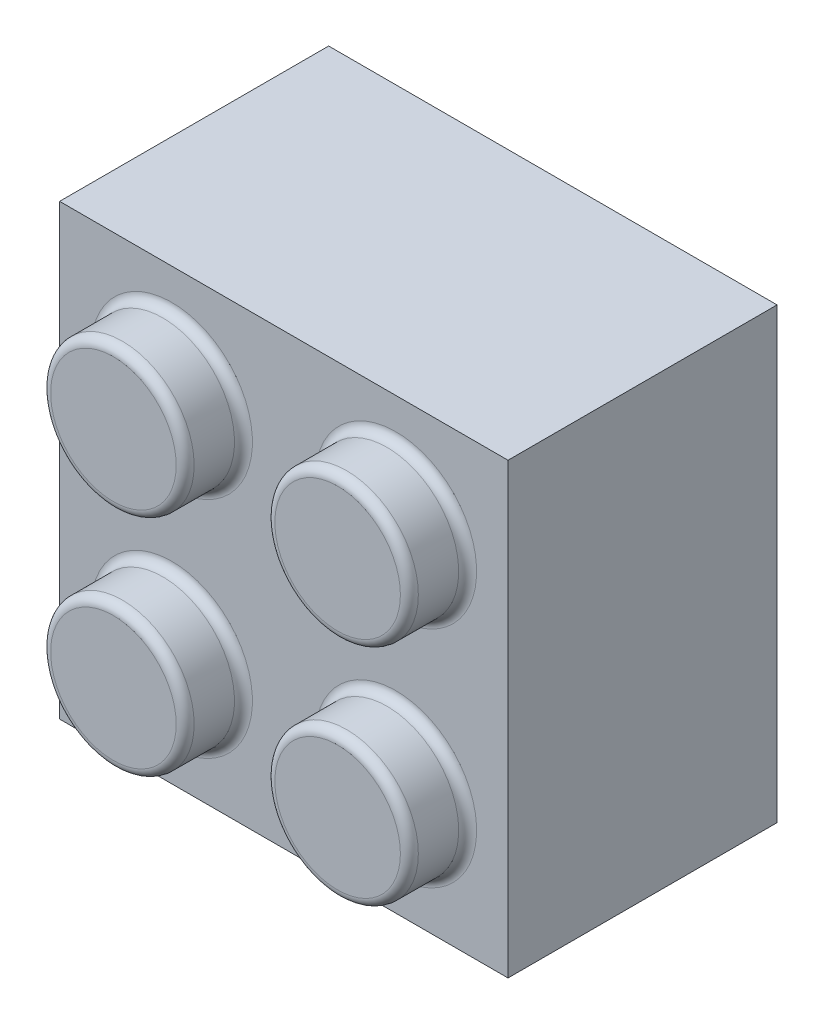
from build123d import *

# Parameters (mm, degrees)
ESQUISSE1_W             = 100
ESQUISSE1_H             = 100
BOSS_EXTRU_2_DEPTH      = 60
ESQUISSE2_R             = 16
BOSS_EXTRU_3_DEPTH      = 13
ESQUISSE3_W             = 84
ESQUISSE3_H             = 84
ESQUISSE3_R             = 18.5
ESQUISSE3_R_2           = 12
ENL_V_MAT_EXTRU_1_DEPTH = 50
CONG_1_R                = 2
CONG_2_R                = 2


with BuildPart() as part:
    # Esquisse1 → Boss.-Extru.2 (new body)
    with BuildSketch(Plane.XY):
        Rectangle(ESQUISSE1_W, ESQUISSE1_H)
    extrude(amount=BOSS_EXTRU_2_DEPTH)

    # Esquisse2 → Boss.-Extru.3 (add)
    with BuildSketch(Plane.XY.offset(60)):
        with Locations(Location((25, 25, 0), (0, 0, 180))):
            Circle(ESQUISSE2_R)
        with Locations(Location((-25, -25, 0), (0, 0, 180))):
            Circle(ESQUISSE2_R)
        with Locations(Location((25, -25, 0), (0, 0, 180))):
            Circle(ESQUISSE2_R)
        with Locations(Location((-25, 25, 0), (0, 0, 180))):
            Circle(ESQUISSE2_R)
    extrude(amount=BOSS_EXTRU_3_DEPTH)

    # Esquisse3 → Enlèv. mat.-Extru.1 (cut)
    # profile 1 of 2: a face of its own
    with BuildSketch(Plane(origin=(0, 0, 0), x_dir=(-1, 0, 0), z_dir=(0, 0, -1))):
        Rectangle(ESQUISSE3_W, ESQUISSE3_H)
        Circle(ESQUISSE3_R, mode=Mode.SUBTRACT)
    # profile 2 of 2: a face of its own
    with BuildSketch(Plane(origin=(0, 0, 0), x_dir=(-1, 0, 0), z_dir=(0, 0, -1))):
        Circle(ESQUISSE3_R_2)
    extrude(amount=-ENL_V_MAT_EXTRU_1_DEPTH, mode=Mode.SUBTRACT)

    # Congé1
    cong_1_edges = [part.edges().sort_by_distance(p)[0] for p in [
        (41, 25, 60),
        (41, 25, 73),
        (-9, -25, 60),
        (-9, -25, 73),
        (41, -25, 60),
        (41, -25, 73),
        (-9, 25, 60),
        (-9, 25, 73),
    ]]
    fillet(cong_1_edges, radius=CONG_1_R)

    # Congé2
    cong_2_edges = [part.edges().sort_by_distance(p)[0] for p in [
        (12, 0, 0),
        (18.5, 0, 0),
        (18.5, 0, 50),
    ]]
    fillet(cong_2_edges, radius=CONG_2_R)


solid = part.part
